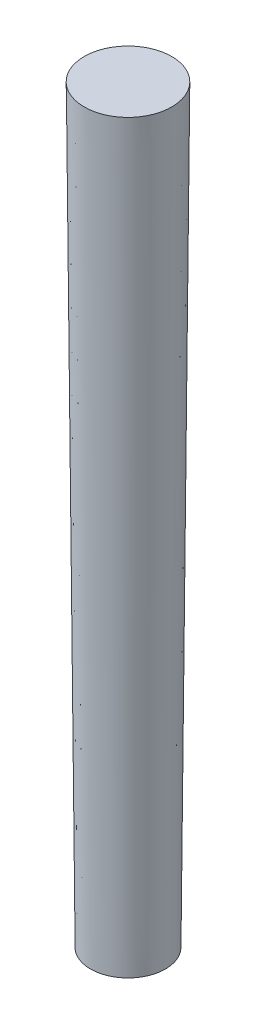
from build123d import *

# Parameters (mm, degrees)
SKETCH1_R           = 3
BOSS_EXTRUDE1_DEPTH = 60
BOSS_EXTRUDE1_DRAFT = -0.4777


with BuildPart() as part:
    # Sketch1 → Boss-Extrude1 (with draft: the straight prism first)
    with BuildSketch(Plane(origin=(0, 0, 0), x_dir=(1, 0, 0), z_dir=(0, 1, 0))):
        Circle(SKETCH1_R)
    extrude(amount=BOSS_EXTRUDE1_DEPTH)
    # Boss-Extrude1: the draft: its side faces are tilted about the plane it starts from
    boss_extrude1_sides = [part.faces().sort_by_distance(p)[0] for p in [
        (-3, 30, 0),
    ]]
    draft(boss_extrude1_sides, Plane(origin=(0, 0, 0), x_dir=(1, 0, 0), z_dir=(0, 1, 0)), BOSS_EXTRUDE1_DRAFT)


solid = part.part
